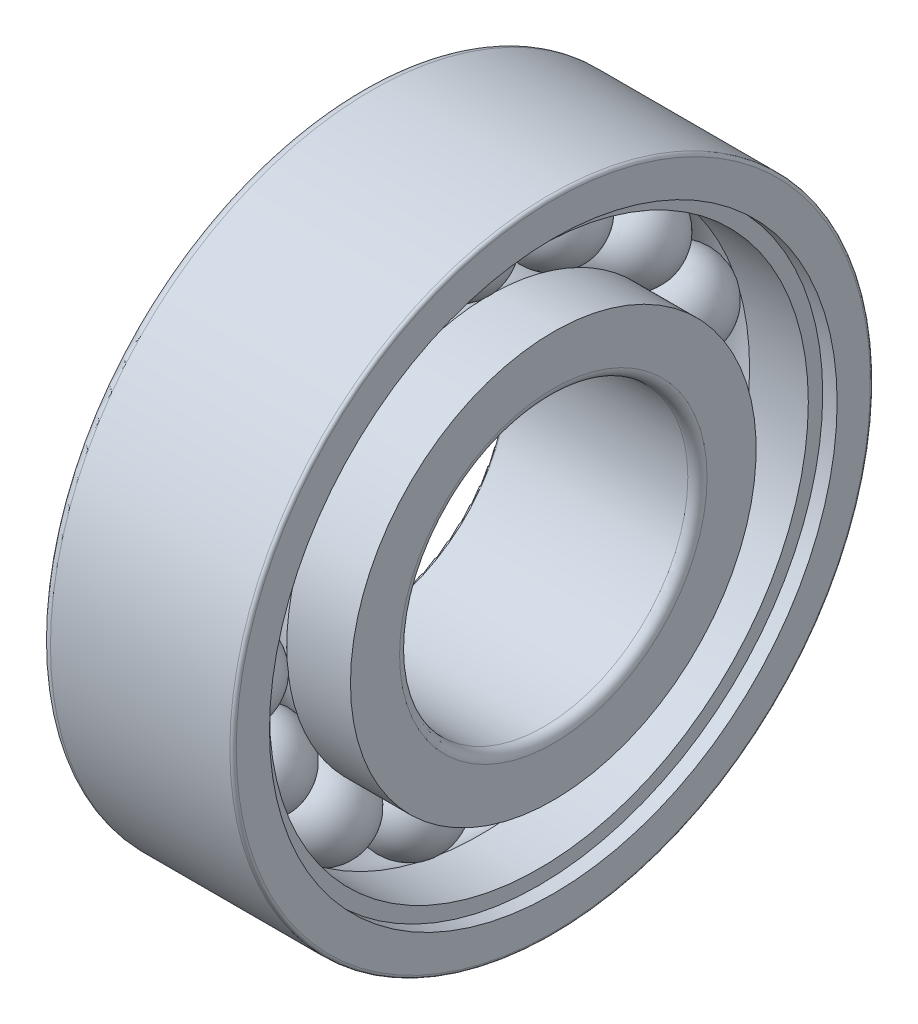
from build123d import *

# Parameters (mm, degrees)
CIRCULAR_PATTERN1_COUNT = 15
FILLET1_R               = 0.3
FILLET2_R               = 0.1


with BuildPart() as part:
    # Sketch1 → Revolve1 (revolve)
    with BuildSketch(Plane.XY):
        with BuildLine():
            Line((-1.375, 7.25), (1.375, 7.25))
            ThreePointArc((1.375, 7.25), (0, 5.875), (-1.375, 7.25))
        make_face()
    revolve1 = revolve(axis=Axis((-3.091912561, 7.25, 0), (1, 0, 0)))

    # Sketch2 → Revolve2 (revolve)
    with BuildSketch(Plane.XY, mode=Mode.PRIVATE) as revolve2_sk:
        with BuildLine():
            Line((-3, 6.333333333), (-1.011408534, 6.333333333))
            ThreePointArc((-1.011408534, 6.333333333), (0, 5.885), (1.011408534, 6.333333333))
            Line((1.011408534, 6.333333333), (3, 6.333333333))
            Line((3, 6.333333333), (3, 4.5))
            Line((3, 4.5), (-3, 4.5))
            Line((-3, 4.5), (-3, 6.333333333))
        make_face()
    revolve(revolve2_sk.sketch.rotate(Axis((-2.992358943, 0, 0), (1, 0, 0)), 90), axis=Axis((-2.992358943, 0, 0), (1, 0, 0)))

    # Sketch3 → Revolve3 (revolve)
    with BuildSketch(Plane.XY, mode=Mode.PRIVATE) as revolve3_sk:
        with BuildLine():
            Line((-3, 8.166666667), (-3, 10))
            Line((-3, 10), (3, 10))
            Line((3, 10), (3, 8.861666667))
            Line((3, 8.861666667), (2.55, 8.861666667))
            Line((2.55, 8.861666667), (2.55, 8.411666667))
            Line((2.55, 8.411666667), (0.716767435, 8.411666667))
            ThreePointArc((0.716767435, 8.411666667), (-0.19159748, 8.601486369), (-1.011408534, 8.166666667))
            Line((-1.011408534, 8.166666667), (-3, 8.166666667))
        make_face()
    revolve(revolve3_sk.sketch.rotate(Axis((-2.992358943, 0, 0), (1, 0, 0)), 90), axis=Axis((-2.992358943, 0, 0), (1, 0, 0)))

    # Circular-Pattern1: Revolve1 ×15 about axis
    circular_pattern1_axis = Axis((0, 0, 0), (1, 0, 0))
    for i in range(1, CIRCULAR_PATTERN1_COUNT):
        add(revolve1.rotate(circular_pattern1_axis, i * 360 / CIRCULAR_PATTERN1_COUNT))

    # Fillet1
    fillet1_edges = [part.edges().sort_by_distance(p)[0] for p in [
        (-3, 0, -10),
        (3, 0, -4.5),
    ]]
    fillet(fillet1_edges, radius=FILLET1_R)

    # Fillet2
    fillet2_edges = [part.edges().sort_by_distance(p)[0] for p in [
        (3, 0, -10),
        (-3, 0, -4.5),
    ]]
    fillet(fillet2_edges, radius=FILLET2_R)


solid = part.part
